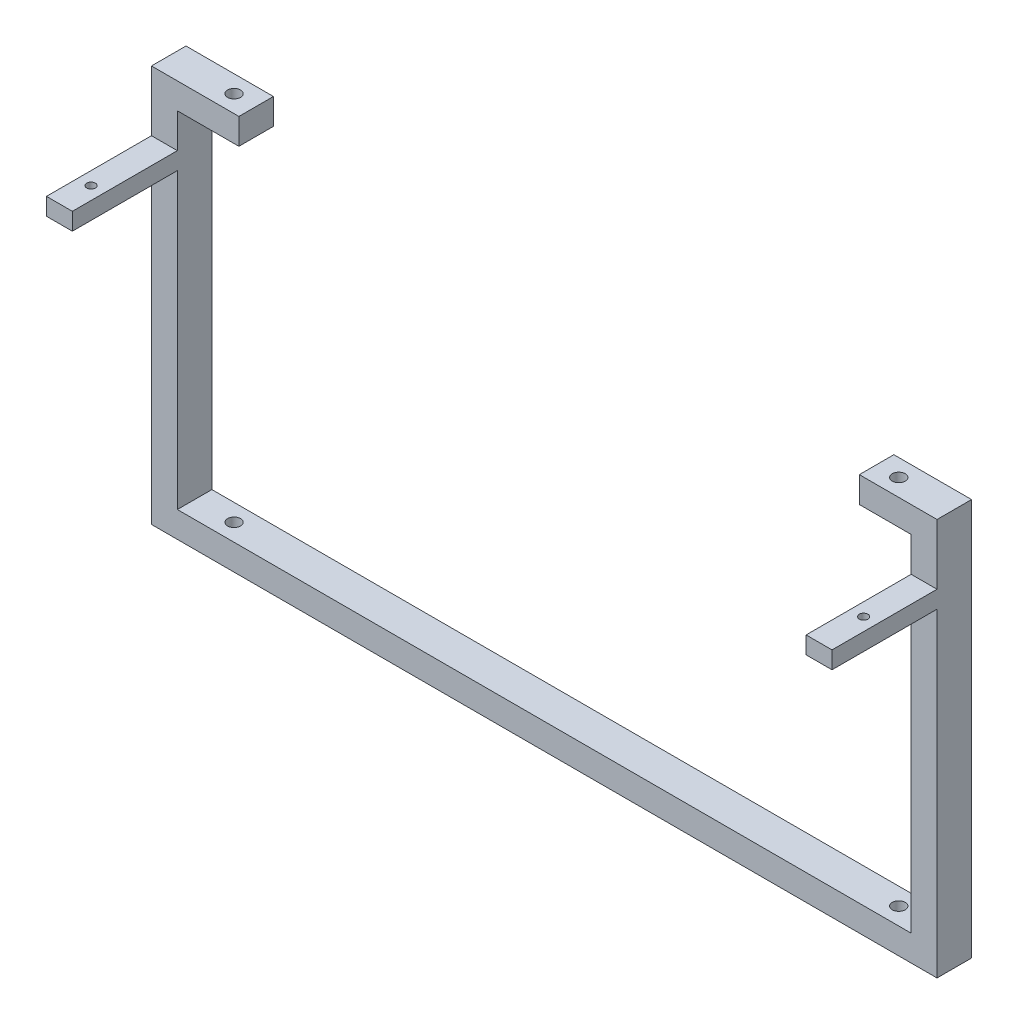
from build123d import *

# Parameters (mm, degrees)
BOSS_EXTRU_1_DEPTH      = 80
ESQUISSE2_R             = 15
ENL_V_MAT_EXTRU_1_DEPTH = 1869.446312251
ESQUISSE3_W             = 60
ESQUISSE3_H             = 283.290811992
ESQUISSE3_R             = 10
BOSS_EXTRU_2_DEPTH      = 20


with BuildPart() as part:
    # Esquisse1 → Boss.-Extru.1 (new body)
    with BuildSketch(Plane.XY):
        Polygon((6.862464031, 0), (-135.71812121, 0), (-135.71812121, -800), (1564.28187879, -800), (1564.28187879, 0), (1444.276814416, 0), (1444.276814416, 60), (1624.28187879, 60), (1624.28187879, -860), (-195.71812121, -860), (-195.71812121, 60), (6.862464031, 60), align=None)
    extrude(amount=BOSS_EXTRU_1_DEPTH)

    # Esquisse2 → Enlèv. mat.-Extru.1 (cut, through all)
    with BuildSketch(Plane(origin=(0, 60, 0), x_dir=(1, 0, 0), z_dir=(0, 1, 0))):
        with Locations(Location((-44.394941641, -40, 0), (0, 0, 180))):
            Circle(ESQUISSE2_R)
        with Locations(Location((1495.605058359, -40, 0), (0, 0, 180))):
            Circle(ESQUISSE2_R)
    extrude(amount=-ENL_V_MAT_EXTRU_1_DEPTH, mode=Mode.SUBTRACT)

    # Esquisse3 → Boss.-Extru.2 (add, symmetric)
    # profile 1 of 2: a face of its own
    with BuildSketch(Plane(origin=(0, -100, 0), x_dir=(1, 0, 0), z_dir=(0, 1, 0))):
        with Locations((-165.71812121, -181.645405996)):
            Rectangle(ESQUISSE3_W, ESQUISSE3_H)
        with Locations(Location((-165.71812121, -250, 0), (0, 0, 270))):
            Circle(ESQUISSE3_R, mode=Mode.SUBTRACT)
    # profile 2 of 2: a face of its own
    with BuildSketch(Plane(origin=(0, -100, 0), x_dir=(1, 0, 0), z_dir=(0, 1, 0))):
        with Locations((1594.28187879, -181.645405996)):
            Rectangle(ESQUISSE3_W, ESQUISSE3_H)
        with Locations(Location((1594.28187879, -220, 0), (0, 0, 270))):
            Circle(ESQUISSE3_R, mode=Mode.SUBTRACT)
    extrude(amount=BOSS_EXTRU_2_DEPTH, both=True)


solid = part.part
